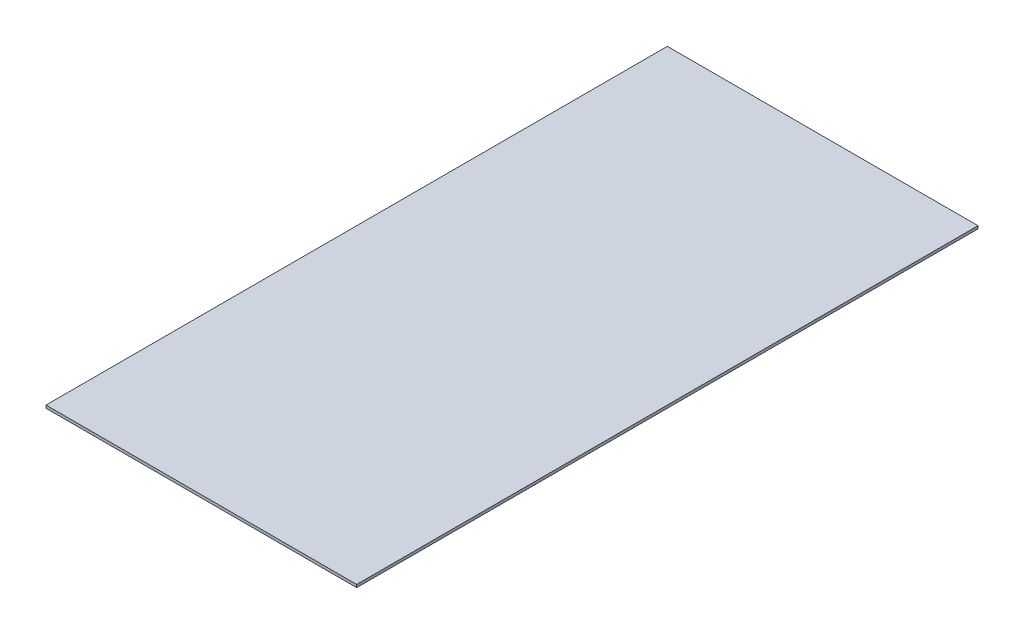
from build123d import *

# Parameters (mm, degrees)
SKETCH1_W           = 1220
SKETCH1_H           = 2440
BOSS_EXTRUDE1_DEPTH = 11


with BuildPart() as part:
    # Sketch1 → Boss-Extrude1 (new body)
    with BuildSketch(Plane(origin=(0, 0, 0), x_dir=(1, 0, 0), z_dir=(0, 1, 0))):
        Rectangle(SKETCH1_W, SKETCH1_H)
    extrude(amount=BOSS_EXTRUDE1_DEPTH)


solid = part.part
